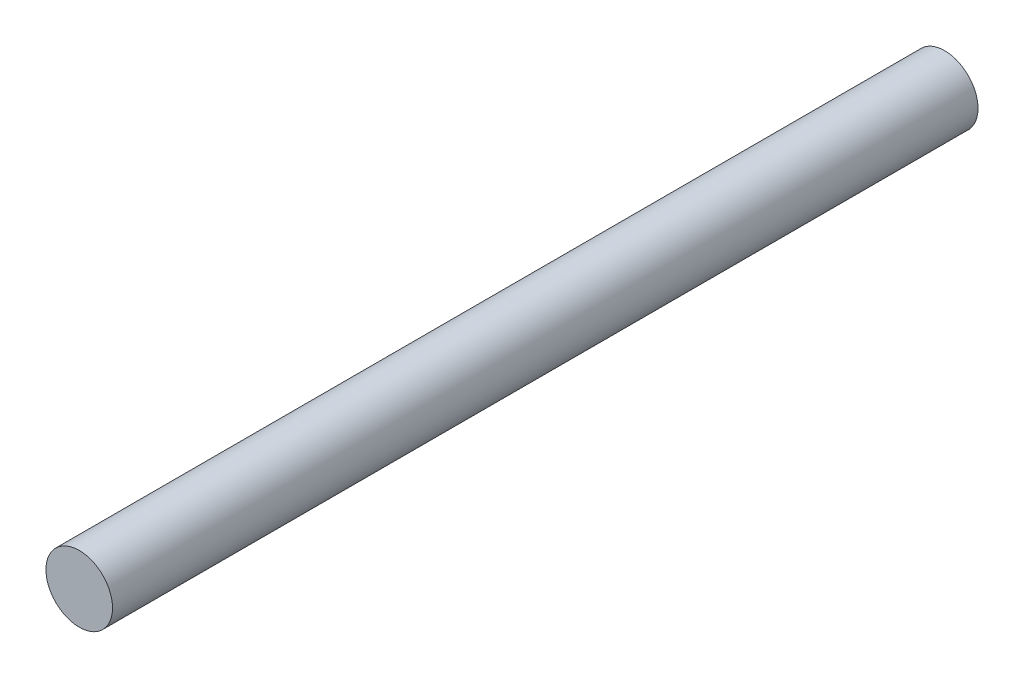
from build123d import *

# Parameters (mm, degrees)
SKETCH2_R           = 5
BOSS_EXTRUDE1_DEPTH = 130


with BuildPart() as part:
    # Sketch2 → Boss-Extrude1 (new body)
    with BuildSketch(Plane.XY):
        Circle(SKETCH2_R)
    extrude(amount=BOSS_EXTRUDE1_DEPTH)


solid = part.part
